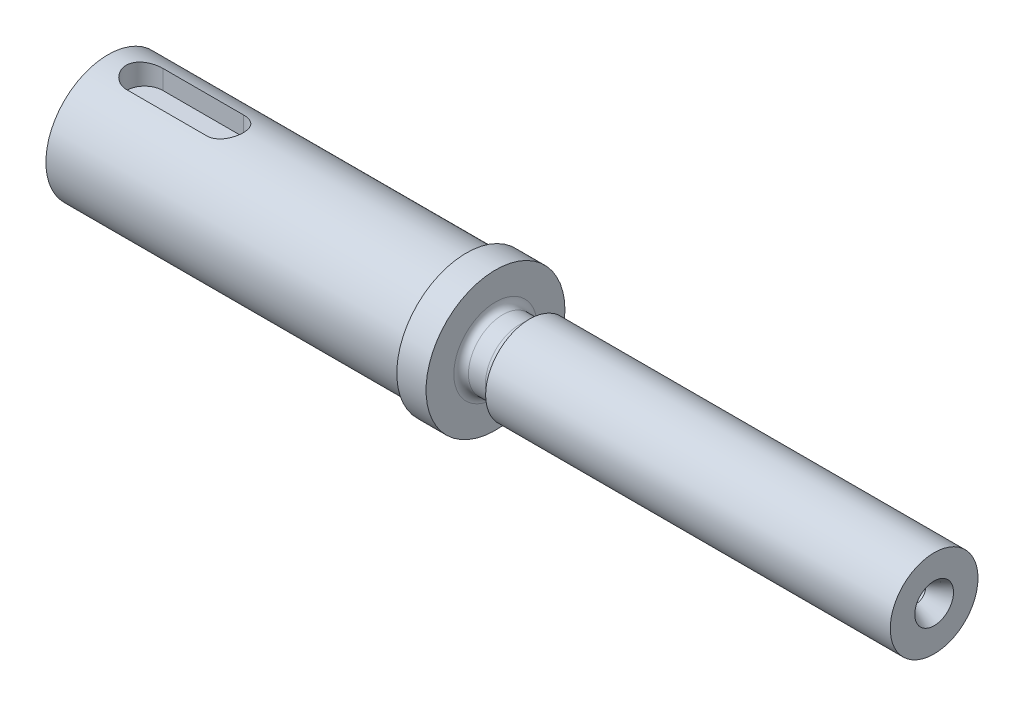
from build123d import *

# Parameters (mm, degrees)
SCHNITT_LINEAR_AUSTRAGEN1_DEPTH = 3
M6_GEWINDEBOHRUNG1_D            = 5
M6_GEWINDEBOHRUNG1_DEPTH        = 20
M6_GEWINDEBOHRUNG1_CSINK_D      = 6
M6_GEWINDEBOHRUNG1_CSINK_ANGLE  = 90
M6_GEWINDEBOHRUNG1_TIP          = 1.502151548


with BuildPart() as part:
    # Skizze1 → Rotation1 (revolve)
    with BuildSketch(Plane.XY, mode=Mode.PRIVATE) as rotation1_sk:
        Polygon((-113, 0), (-113, 8.5), (-64, 8.5), (-64, 9.5), (-60, 9.5), (-60, 6), (0, 6), (0, 0), align=None)
    revolve(rotation1_sk.sketch.rotate(Axis((13.513507739, 0, 0), (-1, 0, 0)), 90), axis=Axis((13.513507739, 0, 0), (-1, 0, 0)))

    # Skizze2 → Schnitt-Linear austragen1 (cut)
    with BuildSketch(Plane(origin=(0, 8.5, 0), x_dir=(-1, 0, 0), z_dir=(0, 1, 0))):
        with BuildLine():
            Line((108, 2.5), (97, 2.5))
            ThreePointArc((97, 2.5), (94.5, 0), (97, -2.5))
            Line((97, -2.5), (108, -2.5))
            ThreePointArc((108, -2.5), (110.5, 0), (108, 2.5))
        make_face()
    extrude(amount=-SCHNITT_LINEAR_AUSTRAGEN1_DEPTH, mode=Mode.SUBTRACT)

    # M6 Gewindebohrung1
    with Locations(Plane.ZY.offset(113)):
        with Locations((0, 0)):
            CounterSinkHole(M6_GEWINDEBOHRUNG1_D / 2, M6_GEWINDEBOHRUNG1_CSINK_D / 2, depth=M6_GEWINDEBOHRUNG1_DEPTH, counter_sink_angle=M6_GEWINDEBOHRUNG1_CSINK_ANGLE)
            with Locations((0, 0, -(M6_GEWINDEBOHRUNG1_DEPTH + M6_GEWINDEBOHRUNG1_TIP / 2))):  # 118° drill point
                Cone(0, M6_GEWINDEBOHRUNG1_D / 2, M6_GEWINDEBOHRUNG1_TIP, mode=Mode.SUBTRACT)

    # Skizze31 → Schnitt-Rotation1 (revolve, cut)
    with BuildSketch(Plane(origin=(-60, 0, 0), x_dir=(-1, 0, 0), z_dir=(0, 0, -1)), mode=Mode.PRIVATE) as schnitt_rotation1_sk:
        with BuildLine():
            Line((-4.65055535, 6), (-4.188675135, 5.2))
            ThreePointArc((-4.188675135, 5.2), (-3.822649731, 4.833974596), (-3.322649731, 4.7))
            Line((-3.322649731, 4.7), (-1, 4.7))
            ThreePointArc((-1, 4.7), (-0.292893219, 4.992893219), (0, 5.7))
            Line((0, 5.7), (0, 6))
            Line((0, 6), (-4.65055535, 6))
        make_face()
    revolve(schnitt_rotation1_sk.sketch.rotate(Axis((-73.677186203, 0, 0), (1, 0, 0)), 90), axis=Axis((-73.677186203, 0, 0), (1, 0, 0)), mode=Mode.SUBTRACT)

    # Skizze32 → Schnitt-Rotation11 (revolve, cut)
    with BuildSketch(Plane(origin=(0, 0, 0), x_dir=(0, 0, -1), z_dir=(0, -1, 0)), mode=Mode.PRIVATE) as schnitt_rotation11_sk:
        Polygon((0, -5.351075774), (1.25, -4.6), (1.25, -2.424871131), (2.65, 0), (0, 0), align=None)
    revolve(schnitt_rotation11_sk.sketch.rotate(Axis((0, 0, 0), (-1, 0, 0)), 270), axis=Axis((0, 0, 0), (-1, 0, 0)), mode=Mode.SUBTRACT)


solid = part.part
